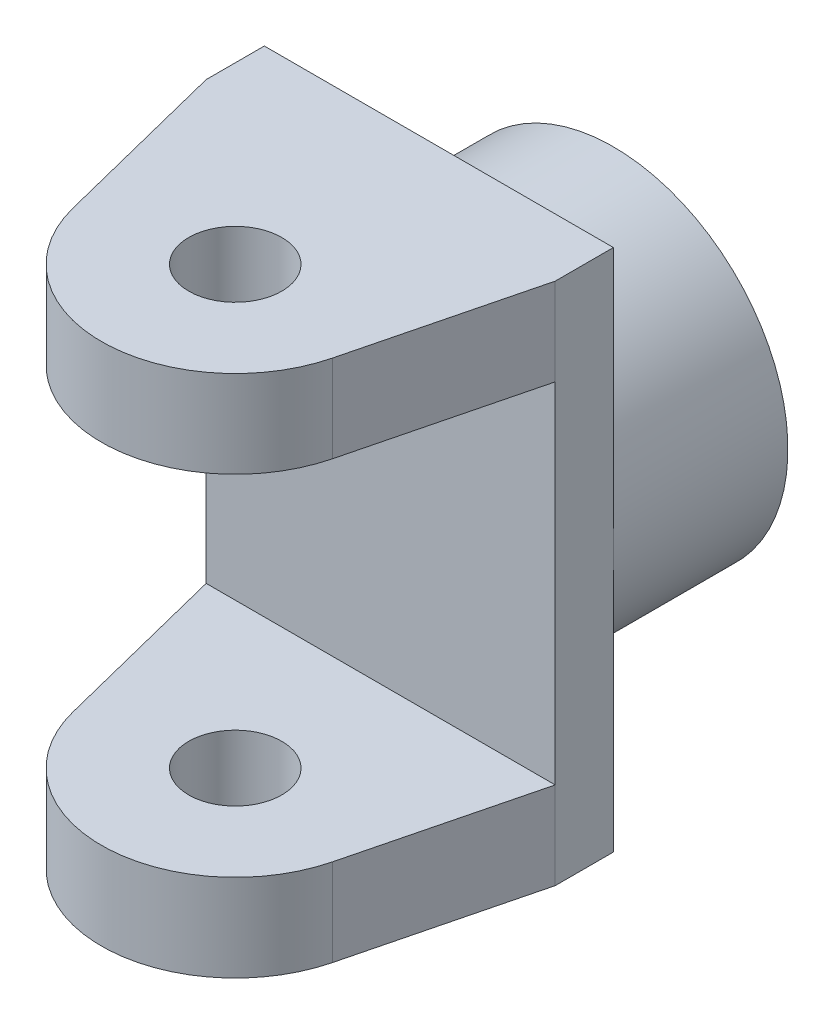
from build123d import *

# Parameters (mm, degrees)
SKETCH1_W           = 60
SKETCH1_H           = 90
BOSS_EXTRUDE1_DEPTH = 10
SKETCH2_R           = 30
BOSS_EXTRUDE2_DEPTH = 30
SKETCH6_R           = 8
BOSS_EXTRUDE3_DEPTH = 15


with BuildPart() as part:
    # Sketch1 → Boss-Extrude1 (new body)
    with BuildSketch(Plane.XY):
        Rectangle(SKETCH1_W, SKETCH1_H)
    extrude(amount=BOSS_EXTRUDE1_DEPTH)

    # Sketch2 → Boss-Extrude2 (add)
    with BuildSketch(Plane(origin=(0, 0, 0), x_dir=(-1, 0, 0), z_dir=(0, 0, -1))):
        Circle(SKETCH2_R)
        with BuildLine():
            Line((4, -13.912685387), (4, -13.325269778))
            ThreePointArc((4, -13.325269778), (0, 13.912685387), (-4, -13.325269778))
            Line((-4, -13.325269778), (-4, -13.912685387))
            Line((-4, -13.912685387), (-4, -16.912685387))
            Line((-4, -16.912685387), (4, -16.912685387))
            Line((4, -16.912685387), (4, -13.912685387))
        make_face(mode=Mode.SUBTRACT)
    extrude(amount=BOSS_EXTRUDE2_DEPTH)

    # Sketch6 → Boss-Extrude3 (add)
    with BuildSketch(Plane(origin=(0, 45, 0), x_dir=(1, 0, 0), z_dir=(0, 1, 0))):
        with BuildLine():
            Line((-30, -10), (-22.306028796, -40.607234555))
            ThreePointArc((-22.306028796, -40.607234555), (0, -58), (22.306028796, -40.607234555))
            Line((22.306028796, -40.607234555), (30, -10))
            Line((30, -10), (-30, -10))
        make_face()
        with Locations(Location((0, -35, 0), (0, 0, 270))):
            Circle(SKETCH6_R, mode=Mode.SUBTRACT)
    boss_extrude3 = extrude(amount=-BOSS_EXTRUDE3_DEPTH)

    # Mirror1: Boss-Extrude3 across plane
    add(boss_extrude3.mirror(Plane.ZX))


solid = part.part
